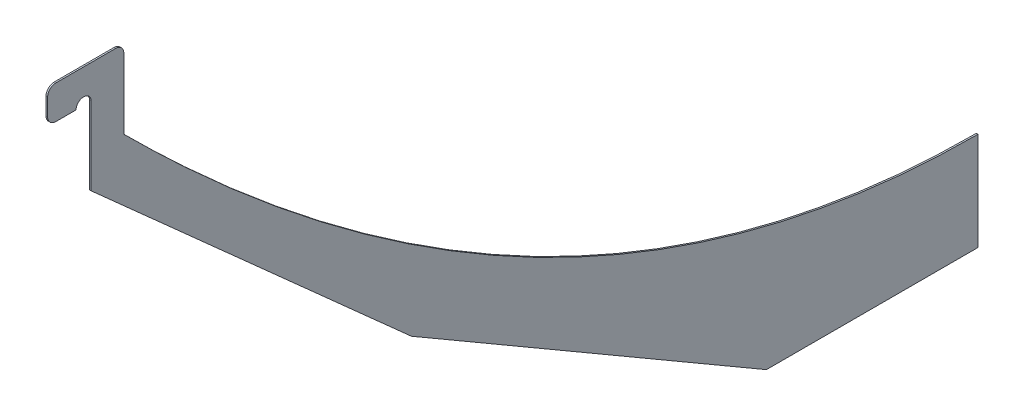
from build123d import *

# Parameters (mm, degrees)
BOSS_EXTRUDE3_DEPTH = 2.54


with BuildPart() as part:
    # Sketch1 → Boss-Extrude3 (new body)
    with BuildSketch(Plane(origin=(0, 0, 0), x_dir=(0, 0, -1), z_dir=(1, 0, 0))):
        with BuildLine():
            Line((-328.770779224, -230.923937708), (-1.3867e-05, -230.923937708))
            Line((-1.3867e-05, -230.923937708), (-1.3866e-05, -78.523920986))
            add(Edge.make_bspline(
                [(-1.3866e-05, -78.523920986), (-663.575061276, -78.523963202), (-1327.150157835, 585.051089401)],
                knots=[0, 0, 0, 1, 1, 1], degree=2))
            Line((-1327.150157835, 585.051089401), (-1327.149864381, 694.252697447))
            ThreePointArc((-1327.149864381, 694.252697447), (-1330.869609261, 703.232955586), (-1339.849867516, 706.952700185))
            Line((-1339.849867516, 706.952700185), (-1432.872655994, 706.952698728))
            ThreePointArc((-1432.872655994, 706.952698728), (-1441.852912057, 703.232954709), (-1445.572655795, 694.25269853))
            Line((-1445.572655795, 694.25269853), (-1445.572655378, 667.601090483))
            ThreePointArc((-1445.572655378, 667.601090483), (-1441.852911359, 658.620834421), (-1432.872655179, 654.901090682))
            Line((-1432.872655179, 654.901090682), (-1401.368674128, 654.901091175))
            ThreePointArc((-1401.368674128, 654.901091175), (-1389.659272694, 666.610488308), (-1377.949874128, 654.901088308))
            Line((-1377.949874128, 654.901088308), (-1377.949874128, 534.251091161))
            Line((-1377.949874128, 534.251091161), (-880.381692198, 89.86268528))
            Line((-880.381692198, 89.86268528), (-328.770779224, -230.923937708))
        make_face()
    extrude(amount=BOSS_EXTRUDE3_DEPTH)


solid = part.part
